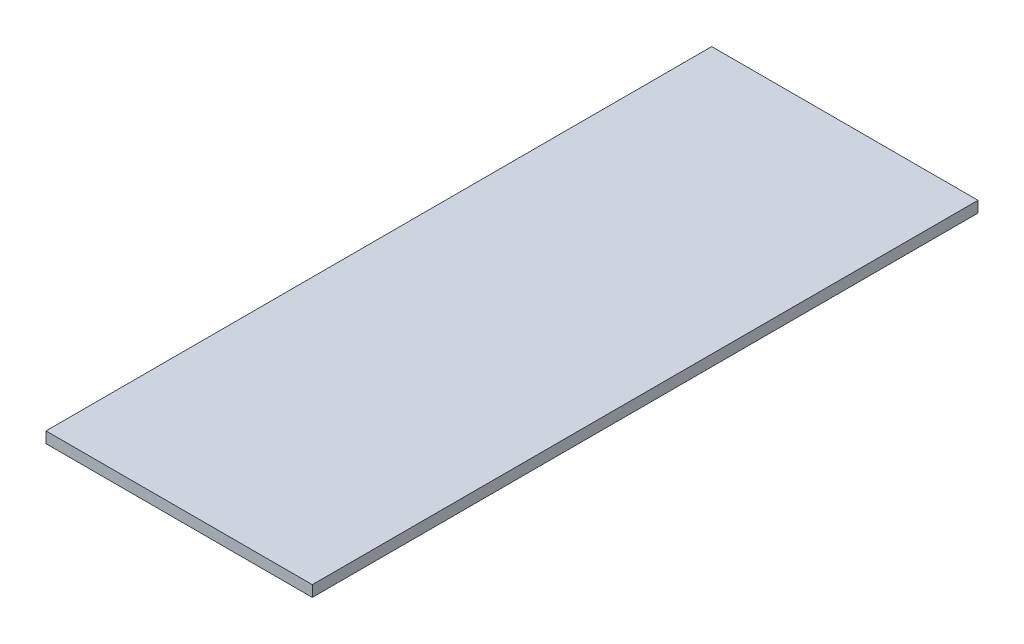
from build123d import *

# Parameters (mm, degrees)
SKETCH1_W      = 152.4
SKETCH1_H      = 381
EXTRUDE1_DEPTH = 6.35


with BuildPart() as part:
    # Sketch1 → Extrude1 (new body)
    with BuildSketch(Plane(origin=(0, 0, 0), x_dir=(1, 0, 0), z_dir=(0, 1, 0))):
        with Locations((-25.202602108, 113.281267969)):
            Rectangle(SKETCH1_W, SKETCH1_H)
    extrude(amount=EXTRUDE1_DEPTH)


solid = part.part
